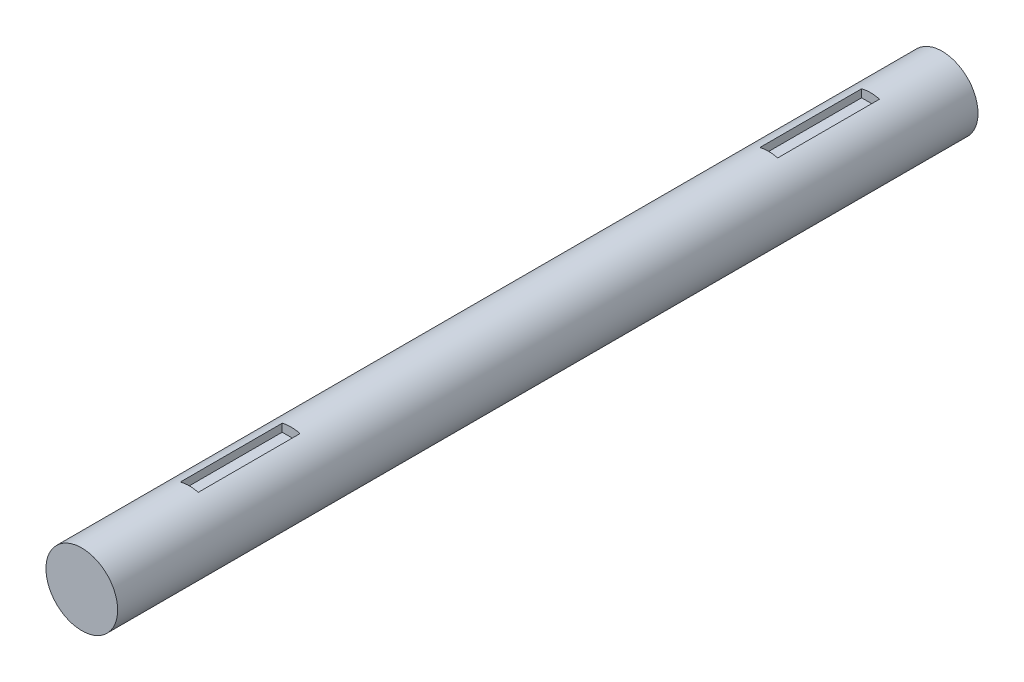
from build123d import *

# Parameters (mm, degrees)
SKETCH1_R           = 6.35
BOSS_EXTRUDE1_DEPTH = 152.4
CUT_EXTRUDE1_DEPTH  = 18.034
CUT_EXTRUDE2_DEPTH  = 18.034


with BuildPart() as part:
    # Sketch1 → Boss-Extrude1 (new body)
    with BuildSketch(Plane.XY):
        with Locations(Location((0, 0, 0), (0, 0, 180))):
            Circle(SKETCH1_R)
    extrude(amount=BOSS_EXTRUDE1_DEPTH)

    # Sketch2 → Cut-Extrude1 (cut)
    with BuildSketch(Plane(origin=(0, 0, 12.7), x_dir=(-1, 0, 0), z_dir=(0, 0, -1))):
        Polygon((1.571433325, 4.7625), (-0.016066675, 4.7625), (-1.603566675, 4.7625), (-1.603566675, 7.9375), (1.571433325, 7.9375), align=None)
    extrude(amount=-CUT_EXTRUDE1_DEPTH, mode=Mode.SUBTRACT)

    # Sketch3 → Cut-Extrude2 (cut)
    with BuildSketch(Plane.XY.offset(133.35)):
        Polygon((0, 4.7625), (1.5875, 4.7625), (1.5875, 7.9375), (-1.5875, 7.9375), (-1.5875, 4.7625), align=None)
    extrude(amount=-CUT_EXTRUDE2_DEPTH, mode=Mode.SUBTRACT)


solid = part.part
